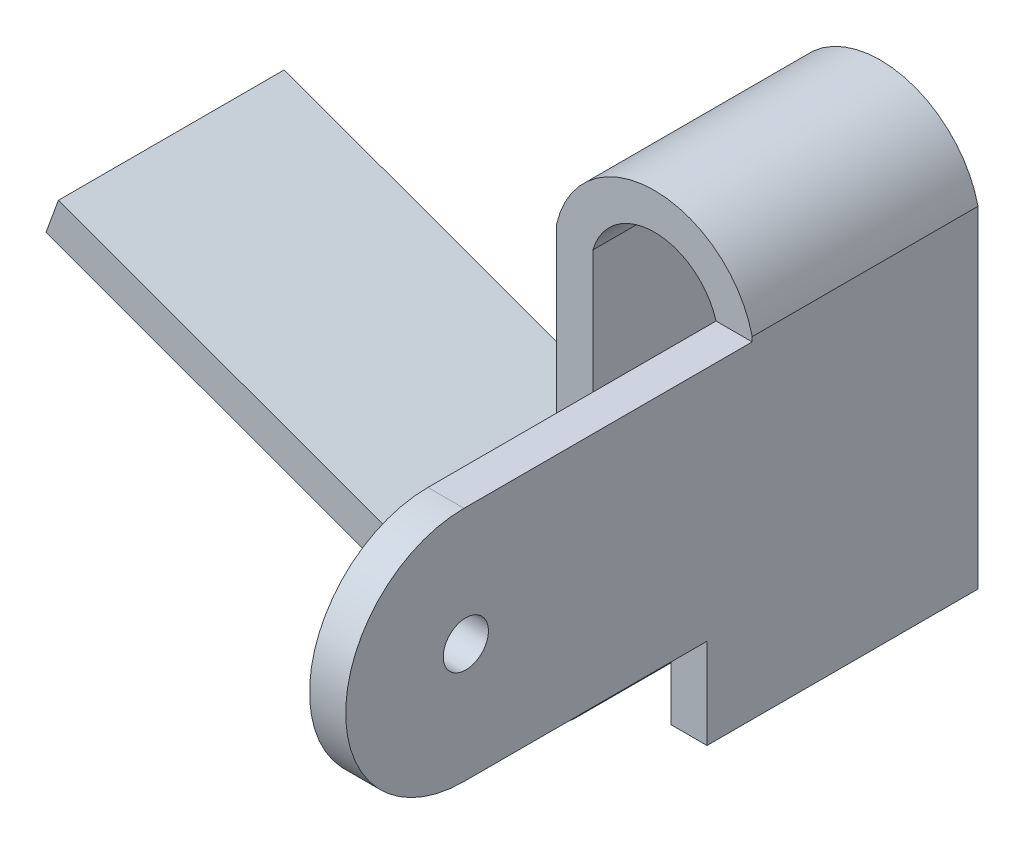
from build123d import *

# Parameters (mm, degrees)
BOSS_EXTRUDE1_DEPTH = 1.25
SKETCH2_W           = 0.4
SKETCH2_H           = 3.619533261
BOSS_EXTRUDE2_DEPTH = 4.5
SKETCH3_W           = 4
SKETCH3_H           = 1
CUT_EXTRUDE1_DEPTH  = 4.5
SKETCH4_R           = 0.25
CUT_EXTRUDE2_DEPTH  = 4.5
FILLET1_RADIUS      = 1.309766631
FILLET1_LENGTH      = 0.4


with BuildPart() as part:
    # Sketch1 → Boss-Extrude1 (new, symmetric)
    with BuildSketch(Plane.XY):
        with BuildLine():
            Line((0, 0), (0, 3.67))
            ThreePointArc((0, 3.67), (-1.08183729, 4.531548642), (-2.163674581, 3.67))
            Line((-2.163674581, 3.67), (-2.163674581, -0.5))
            ThreePointArc((-2.163674581, -0.5), (-2.274544707, -0.712979532), (-2.512599818, -0.744320081))
            Line((-2.512599818, -0.744320081), (-7.680909232, 1.136790707))
            Line((-7.680909232, 1.136790707), (-7.817717289, 0.760913659))
            Line((-7.817717289, 0.760913659), (-2.649407875, -1.12019713))
            ThreePointArc((-2.649407875, -1.12019713), (-2.045114133, -1.040640349), (-1.763674581, -0.5))
            Line((-1.763674581, -0.5), (-1.763674581, 3.619533261))
            ThreePointArc((-1.763674581, 3.619533261), (-1.08183729, 4.131548642), (-0.4, 3.619533261))
            Line((-0.4, 3.619533261), (-0.4, 0))
            Line((-0.4, 0), (0, 0))
        make_face()
    extrude(amount=BOSS_EXTRUDE1_DEPTH, both=True)

    # Sketch2 → Boss-Extrude2 (add)
    with BuildSketch(Plane.XY.offset(1.25)):
        with Locations((-0.2, 1.809766631)):
            Rectangle(SKETCH2_W, SKETCH2_H)
    extrude(amount=BOSS_EXTRUDE2_DEPTH)

    # Sketch3 → Cut-Extrude1 (cut)
    with BuildSketch(Plane(origin=(0, 0, 0), x_dir=(0, 0, -1), z_dir=(1, 0, 0))):
        with Locations((-3.75, 0.5)):
            Rectangle(SKETCH3_W, SKETCH3_H)
    extrude(amount=-CUT_EXTRUDE1_DEPTH, mode=Mode.SUBTRACT)

    # Sketch4 → Cut-Extrude2 (cut)
    with BuildSketch(Plane(origin=(0, 0, 0), x_dir=(0, 0, -1), z_dir=(1, 0, 0))):
        with Locations((-4.42, 2.309766631)):
            Circle(SKETCH4_R)
    extrude(amount=-CUT_EXTRUDE2_DEPTH, mode=Mode.SUBTRACT)

    # Fillet1: full round fillet: the end face becomes a half cylinder, R = half its width
    fillet1_face = Plane((-0.2, 2.309766631, 5.75), x_dir=(-1, 0, 0), z_dir=(0, 0, 1))  # on the end face: x along it, z out of the body
    fillet1_slab = fillet1_face.offset(-FILLET1_RADIUS / 2) * Box(FILLET1_LENGTH, 2 * FILLET1_RADIUS, FILLET1_RADIUS, mode=Mode.PRIVATE)  # the body's end, R deep
    fillet1_round = Plane((-0.2, 2.309766631, 4.440233369), x_dir=(0, 0, 1), z_dir=(-1, 0, 0)) * Cylinder(FILLET1_RADIUS, FILLET1_LENGTH, mode=Mode.PRIVATE)  # its axis R under the face
    add(fillet1_slab - fillet1_round, mode=Mode.SUBTRACT)


solid = part.part
